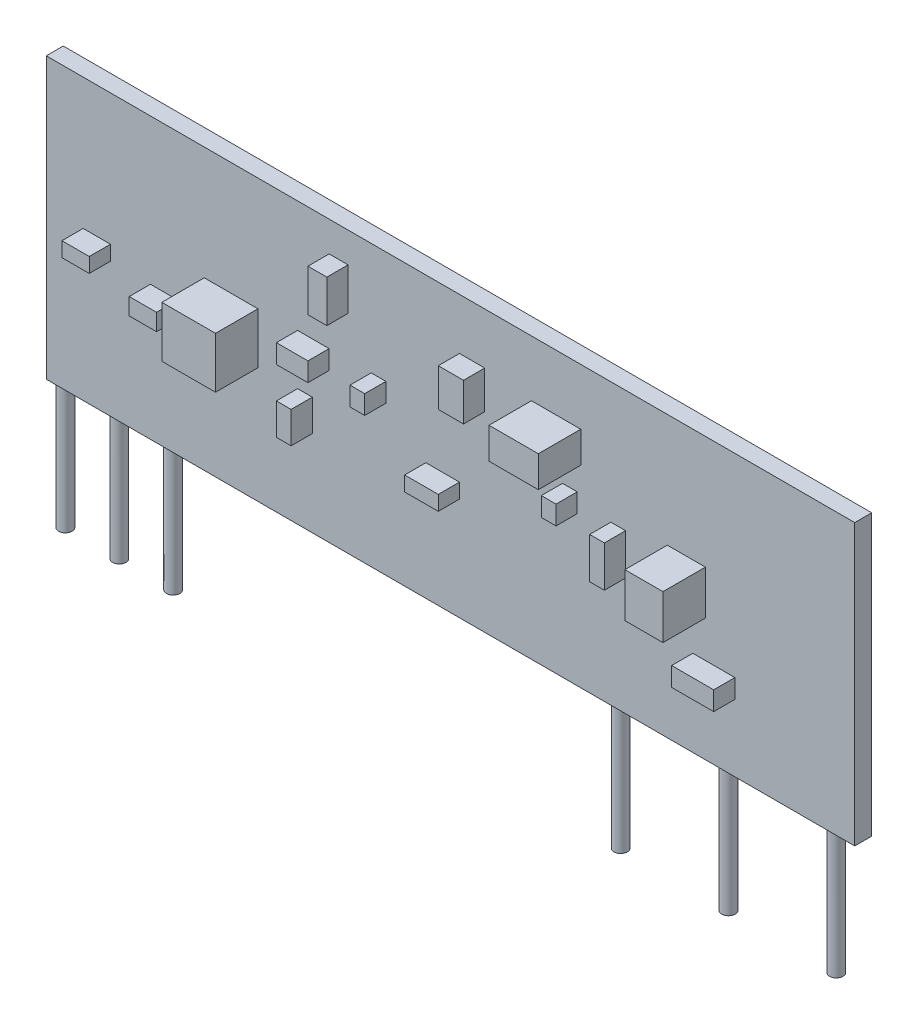
from build123d import *

# Parameters (mm, degrees)
ESQUISSE1_W        = 38.1
ESQUISSE1_H        = 13.2
BOSS_EXTRU_1_DEPTH = 0.8
ESQUISSE2_R        = 0.315
BOSS_EXTRU_2_DEPTH = 6
ESQUISSE3_W        = 2.528787401
ESQUISSE3_H        = 2.40642672
ESQUISSE3_W_2      = 2.324852932
ESQUISSE3_H_2      = 1.468328168
ESQUISSE3_W_3      = 1.794623316
ESQUISSE3_H_3      = 2.080131572
BOSS_EXTRU_3_DEPTH = 2
ESQUISSE4_W        = 1.288030783
ESQUISSE4_H        = 0.792634328
ESQUISSE4_H_2      = 0.693555037
ESQUISSE4_W_2      = 0.693555037
ESQUISSE4_H_3      = 1.486189366
ESQUISSE4_W_3      = 1.486189365
ESQUISSE4_H_4      = 0.891713619
ESQUISSE4_W_4      = 1.585268657
ESQUISSE4_W_5      = 0.891713619
ESQUISSE4_H_5      = 1.981585821
ESQUISSE4_W_6      = 1.188951492
ESQUISSE4_H_6      = 1.783427238
ESQUISSE4_H_7      = 1.932046175
ESQUISSE4_W_7      = 1.98158582
BOSS_EXTRU_8_DEPTH = 1


with BuildPart() as part:
    # Esquisse1 → Boss.-Extru.1 (new body)
    with BuildSketch(Plane.XY):
        with Locations((19.05, 6.6)):
            Rectangle(ESQUISSE1_W, ESQUISSE1_H)
    extrude(amount=BOSS_EXTRU_1_DEPTH)

    # Esquisse2 → Boss.-Extru.2 (add)
    with BuildSketch(Plane.XZ):
        with Locations(Location((0.5, 0.399671485, 0), (0, 0, 90))):
            Circle(ESQUISSE2_R)
        with Locations(Location((3.04, 0.399671485, 0), (0, 0, 90))):
            Circle(ESQUISSE2_R)
        with Locations(Location((5.58, 0.399671485, 0), (0, 0, 90))):
            Circle(ESQUISSE2_R)
        with Locations(Location((26.67, 0.399671485, 0), (0, 0, 90))):
            Circle(ESQUISSE2_R)
        with Locations(Location((31.75, 0.399671485, 0), (0, 0, 90))):
            Circle(ESQUISSE2_R)
        with Locations(Location((36.83, 0.399671485, 0), (0, 0, 90))):
            Circle(ESQUISSE2_R)
    extrude(amount=BOSS_EXTRU_2_DEPTH)

    # Esquisse3 → Boss.-Extru.3 (add)
    with BuildSketch(Plane.XY.offset(0.8)):
        with Locations((8.710522484, 6.659017017)):
            Rectangle(ESQUISSE3_W, ESQUISSE3_H)
        with Locations((24.026001014, 9.820001267)):
            Rectangle(ESQUISSE3_W_2, ESQUISSE3_H_2)
        with Locations((30.164428494, 6.822164591)):
            Rectangle(ESQUISSE3_W_3, ESQUISSE3_H_3)
    extrude(amount=BOSS_EXTRU_3_DEPTH)

    # Esquisse4 → Boss.-Extru.8 (add)
    with BuildSketch(Plane.XY.offset(0.8)):
        with Locations((5.552416897, 5.933480073)):
            Rectangle(ESQUISSE4_W, ESQUISSE4_H)
        with Locations((2.381879584, 6.676574756)):
            Rectangle(ESQUISSE4_W, ESQUISSE4_H_2)
        with Locations((12.190729396, 4.794068226)):
            Rectangle(ESQUISSE4_W_2, ESQUISSE4_H_3)
        with Locations((12.58704656, 7.469209084)):
            Rectangle(ESQUISSE4_W_3, ESQUISSE4_H_4)
        with Locations((18.680422957, 5.190385391)):
            Rectangle(ESQUISSE4_W_4, ESQUISSE4_H_2)
        with Locations((15.658504582, 7.469209084)):
            Rectangle(ESQUISSE4_W_2, ESQUISSE4_H_4)
        with Locations((13.775998052, 10.788365333)):
            Rectangle(ESQUISSE4_W_5, ESQUISSE4_H_5)
        with Locations((20.067533032, 9.896651714)):
            Rectangle(ESQUISSE4_W_6, ESQUISSE4_H_6)
        with Locations((24.674720065, 7.469209084)):
            Rectangle(ESQUISSE4_W_2, ESQUISSE4_H_4)
        with Locations((26.953543759, 6.503185997)):
            Rectangle(ESQUISSE4_W_2, ESQUISSE4_H_7)
        with Locations((31.4616515, 3.605116734)):
            Rectangle(ESQUISSE4_W_7, ESQUISSE4_H_4)
    extrude(amount=BOSS_EXTRU_8_DEPTH)


solid = part.part
